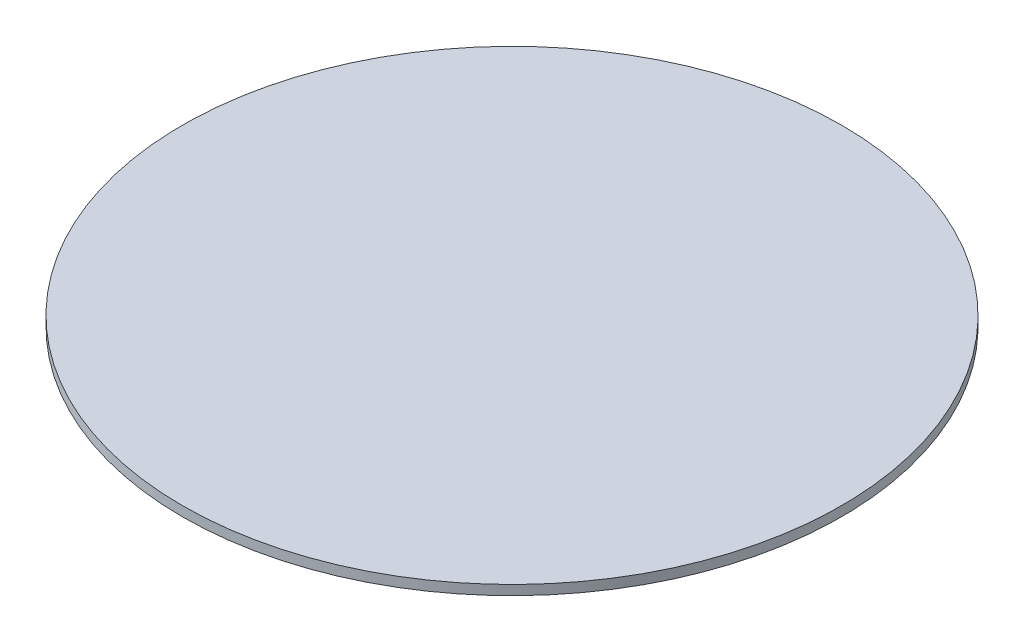
from build123d import *

# Parameters (mm, degrees)
SKETCH_1_R             = 170
EXTRUDE_1_DEPTH        = 5
SKETCH_7_R             = 2
CUT_EXTRUDE_3_DEPTH    = 3
SKETCH_9_R             = 2
CUT_EXTRUDE_4_DEPTH    = 3
SKETCH_11_R            = 2
CUT_EXTRUDE_5_DEPTH    = 3
SKETCH_12_R            = 2
CUT_EXTRUDE_6_DEPTH    = 3
PATTERN_LINEAR_1_COUNT = 5
PATTERN_LINEAR_1_PITCH = 12
SKETCH_13_R            = 2
CUT_EXTRUDE_7_DEPTH    = 3
PATTERN_LINEAR_3_COUNT = 5
PATTERN_LINEAR_3_PITCH = 12
SKETCH_14_W            = 84.328849506
SKETCH_14_H            = 12.891034319
SKETCH_14_W_2          = 78.927431616
SKETCH_14_H_2          = 12.392344403
EXTRUDE_2_DEPTH        = 4


with BuildPart() as part:
    # 草图1 → 凸台-拉伸1 (new body)
    with BuildSketch(Plane(origin=(0, 0, 0), x_dir=(1, 0, 0), z_dir=(0, 1, 0))):
        with Locations(Location((0, 0, 0), (0, 0, 270))):
            Circle(SKETCH_1_R)
    extrude(amount=EXTRUDE_1_DEPTH)

    # 草图7 → 切除-拉伸3 (cut)
    with BuildSketch(Plane.XZ):
        with Locations(Location((-72, 20.5, 0), (0, 0, 270))):
            Circle(SKETCH_7_R)
        with Locations(Location((-7, 20.5, 0), (0, 0, 270))):
            Circle(SKETCH_7_R)
        with Locations(Location((-72, -44.5, 0), (0, 0, 270))):
            Circle(SKETCH_7_R)
        with Locations(Location((-7, -44.5, 0), (0, 0, 270))):
            Circle(SKETCH_7_R)
        with Locations(Location((7, -20.5, 0), (0, 0, 270))):
            Circle(SKETCH_7_R)
        with Locations(Location((72, -20.5, 0), (0, 0, 270))):
            Circle(SKETCH_7_R)
        with Locations(Location((7, 44.5, 0), (0, 0, 270))):
            Circle(SKETCH_7_R)
        with Locations(Location((72, 44.5, 0), (0, 0, 270))):
            Circle(SKETCH_7_R)
    extrude(amount=-CUT_EXTRUDE_3_DEPTH, mode=Mode.SUBTRACT)

    # 草图9 → 切除-拉伸4 (cut)
    with BuildSketch(Plane.XZ):
        with Locations(Location((-72, 32.5, 0), (0, 0, 270))):
            Circle(SKETCH_9_R)
        with Locations(Location((-72, -32.5, 0), (0, 0, 270))):
            Circle(SKETCH_9_R)
        with Locations(Location((72, 32.5, 0), (0, 0, 270))):
            Circle(SKETCH_9_R)
        with Locations(Location((72, -32.5, 0), (0, 0, 270))):
            Circle(SKETCH_9_R)
        with Locations(Location((-7, 32.5, 0), (0, 0, 270))):
            Circle(SKETCH_9_R)
        with Locations(Location((7, 32.5, 0), (0, 0, 270))):
            Circle(SKETCH_9_R)
        with Locations(Location((7, -32.5, 0), (0, 0, 270))):
            Circle(SKETCH_9_R)
        with Locations(Location((-7, -32.5, 0), (0, 0, 270))):
            Circle(SKETCH_9_R)
    extrude(amount=-CUT_EXTRUDE_4_DEPTH, mode=Mode.SUBTRACT)

    # 草图11 → 切除-拉伸5 (cut)
    with BuildSketch(Plane.XZ):
        with Locations(Location((-72, 8.5, 0), (0, 0, 270))):
            Circle(SKETCH_11_R)
        with Locations(Location((7, 20.5, 0), (0, 0, 270))):
            Circle(SKETCH_11_R)
        with Locations(Location((7, 8.5, 0), (0, 0, 270))):
            Circle(SKETCH_11_R)
        with Locations(Location((72, 20.5, 0), (0, 0, 270))):
            Circle(SKETCH_11_R)
        with Locations(Location((72, 8.5, 0), (0, 0, 270))):
            Circle(SKETCH_11_R)
        with Locations(Location((7, -44.5, 0), (0, 0, 270))):
            Circle(SKETCH_11_R)
        with Locations(Location((7, -56.5, 0), (0, 0, 270))):
            Circle(SKETCH_11_R)
        with Locations(Location((-72, 56.5, 0), (0, 0, 270))):
            Circle(SKETCH_11_R)
        with Locations(Location((-72, 44.5, 0), (0, 0, 270))):
            Circle(SKETCH_11_R)
        with Locations(Location((-72, -8.5, 0), (0, 0, 270))):
            Circle(SKETCH_11_R)
        with Locations(Location((-72, -20.5, 0), (0, 0, 270))):
            Circle(SKETCH_11_R)
        with Locations(Location((-7, 8.5, 0), (0, 0, 270))):
            Circle(SKETCH_11_R)
        with Locations(Location((-72, -56.5, 0), (0, 0, 270))):
            Circle(SKETCH_11_R)
        with Locations(Location((-7, -56.5, 0), (0, 0, 270))):
            Circle(SKETCH_11_R)
        with Locations(Location((72, -44.5, 0), (0, 0, 270))):
            Circle(SKETCH_11_R)
        with Locations(Location((72, -56.5, 0), (0, 0, 270))):
            Circle(SKETCH_11_R)
        with Locations(Location((-7, 44.5, 0), (0, 0, 270))):
            Circle(SKETCH_11_R)
        with Locations(Location((-7, -20.5, 0), (0, 0, 270))):
            Circle(SKETCH_11_R)
        with Locations(Location((-7, 56.5, 0), (0, 0, 270))):
            Circle(SKETCH_11_R)
        with Locations(Location((7, 56.5, 0), (0, 0, 270))):
            Circle(SKETCH_11_R)
        with Locations(Location((72, 56.5, 0), (0, 0, 270))):
            Circle(SKETCH_11_R)
        with Locations(Location((-7, -8.5, 0), (0, 0, 270))):
            Circle(SKETCH_11_R)
        with Locations(Location((7, -8.5, 0), (0, 0, 270))):
            Circle(SKETCH_11_R)
        with Locations(Location((72, -8.5, 0), (0, 0, 270))):
            Circle(SKETCH_11_R)
    extrude(amount=-CUT_EXTRUDE_5_DEPTH, mode=Mode.SUBTRACT)

    # 草图12 → 切除-拉伸6 (cut)
    with BuildSketch(Plane.XZ):
        with Locations(Location((0, 56.5, 0), (0, 0, 270))):
            Circle(SKETCH_12_R)
        with Locations(Location((-79, 56.5, 0), (0, 0, 270))):
            Circle(SKETCH_12_R)
        with Locations(Location((-65, 56.5, 0), (0, 0, 270))):
            Circle(SKETCH_12_R)
        with Locations(Location((-86, 56.5, 0), (0, 0, 270))):
            Circle(SKETCH_12_R)
        with Locations(Location((-58, 56.5, 0), (0, 0, 270))):
            Circle(SKETCH_12_R)
        with Locations(Location((-14, 56.5, 0), (0, 0, 270))):
            Circle(SKETCH_12_R)
        with Locations(Location((-21, 56.5, 0), (0, 0, 270))):
            Circle(SKETCH_12_R)
        with Locations(Location((14, 56.5, 0), (0, 0, 270))):
            Circle(SKETCH_12_R)
        with Locations(Location((21, 56.5, 0), (0, 0, 270))):
            Circle(SKETCH_12_R)
        with Locations(Location((86, 56.5, 0), (0, 0, 270))):
            Circle(SKETCH_12_R)
        with Locations(Location((79, 56.5, 0), (0, 0, 270))):
            Circle(SKETCH_12_R)
        with Locations(Location((65, 56.5, 0), (0, 0, 270))):
            Circle(SKETCH_12_R)
        with Locations(Location((58, 56.5, 0), (0, 0, 270))):
            Circle(SKETCH_12_R)
    cut_extrude_6 = extrude(amount=-CUT_EXTRUDE_6_DEPTH, mode=Mode.SUBTRACT)

    # 阵列(线性)1: 切除-拉伸6 ×5
    with Locations(*[(0, 0, -i * PATTERN_LINEAR_1_PITCH) for i in range(1, PATTERN_LINEAR_1_COUNT)]):
        add(cut_extrude_6, mode=Mode.SUBTRACT)

    # 草图13 → 切除-拉伸7 (cut)
    with BuildSketch(Plane.XZ):
        with Locations(Location((-86, -8.5, 0), (0, 0, 270))):
            Circle(SKETCH_13_R)
        with Locations(Location((-79, -8.5, 0), (0, 0, 270))):
            Circle(SKETCH_13_R)
        with Locations(Location((-65, -8.5, 0), (0, 0, 270))):
            Circle(SKETCH_13_R)
        with Locations(Location((-58, -8.5, 0), (0, 0, 270))):
            Circle(SKETCH_13_R)
        with Locations(Location((86, -8.5, 0), (0, 0, 270))):
            Circle(SKETCH_13_R)
        with Locations(Location((79, -8.5, 0), (0, 0, 270))):
            Circle(SKETCH_13_R)
        with Locations(Location((65, -8.5, 0), (0, 0, 270))):
            Circle(SKETCH_13_R)
        with Locations(Location((58, -8.5, 0), (0, 0, 270))):
            Circle(SKETCH_13_R)
        with Locations(Location((0, -8.5, 0), (0, 0, 270))):
            Circle(SKETCH_13_R)
        with Locations(Location((14, -8.5, 0), (0, 0, 270))):
            Circle(SKETCH_13_R)
        with Locations(Location((21, -8.5, 0), (0, 0, 270))):
            Circle(SKETCH_13_R)
        with Locations(Location((-14, -8.5, 0), (0, 0, 270))):
            Circle(SKETCH_13_R)
        with Locations(Location((-21, -8.5, 0), (0, 0, 270))):
            Circle(SKETCH_13_R)
    cut_extrude_7 = extrude(amount=-CUT_EXTRUDE_7_DEPTH, mode=Mode.SUBTRACT)

    # 阵列(线性)3: 切除-拉伸7 ×5
    with Locations(*[(0, 0, -i * PATTERN_LINEAR_3_PITCH) for i in range(1, PATTERN_LINEAR_3_COUNT)]):
        add(cut_extrude_7, mode=Mode.SUBTRACT)

    # 草图14 → 凸台-拉伸2 (add)
    with BuildSketch(Plane.XZ):
        with Locations((-52.004899409, 57.852255926)):
            Rectangle(SKETCH_14_W, SKETCH_14_H)
        with Locations((50.634574828, -56.92984721)):
            Rectangle(SKETCH_14_W_2, SKETCH_14_H_2)
    extrude(amount=-EXTRUDE_2_DEPTH)


solid = part.part
